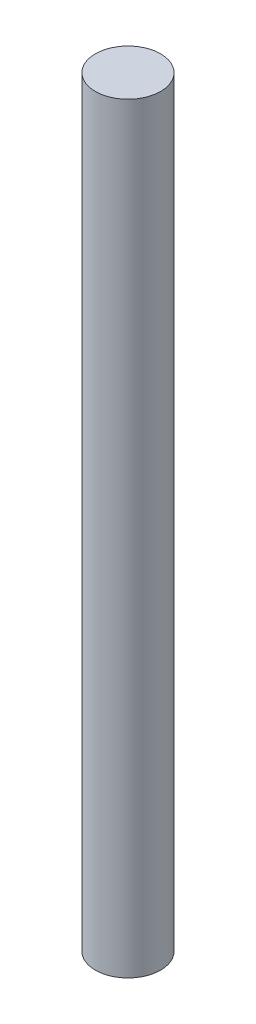
from build123d import *

# Parameters (mm, degrees)
SKETCH_1_R      = 1.5
EXTRUDE_1_DEPTH = 35


with BuildPart() as part:
    # 草图1 → 凸台-拉伸1 (new body)
    with BuildSketch(Plane(origin=(0, 0, 0), x_dir=(1, 0, 0), z_dir=(0, 1, 0))):
        with Locations(Location((0, 0, 0), (0, 0, 270))):
            Circle(SKETCH_1_R)
    extrude(amount=EXTRUDE_1_DEPTH)


solid = part.part
